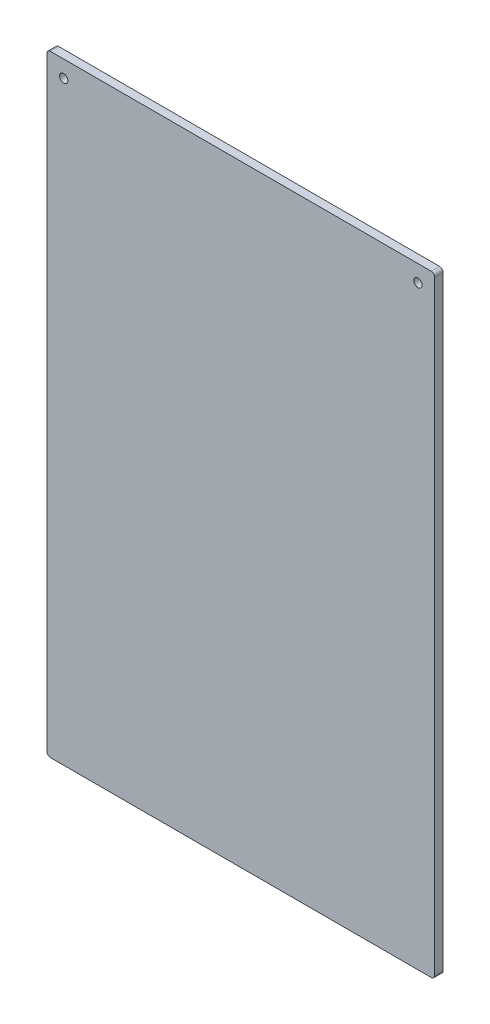
from build123d import *

# Parameters (mm, degrees)
SKETCH1_W           = 294.64
SKETCH1_H           = 464.82
SKETCH1_R           = 3.175
BOSS_EXTRUDE1_DEPTH = 6.35
FILLET1_R           = 2.54


with BuildPart() as part:
    # Sketch1 → Boss-Extrude1 (new body)
    with BuildSketch(Plane.XY):
        with Locations((147.32, 232.41)):
            Rectangle(SKETCH1_W, SKETCH1_H)
        with Locations((12.7, 452.12)):
            Circle(SKETCH1_R, mode=Mode.SUBTRACT)
        with Locations((281.94, 452.12)):
            Circle(SKETCH1_R, mode=Mode.SUBTRACT)
    extrude(amount=BOSS_EXTRUDE1_DEPTH)

    # Fillet1
    fillet1_edges = [part.edges().sort_by_distance(p)[0] for p in [
        (0, 464.82, 3.175),
        (294.64, 464.82, 3.175),
        (294.64, 0, 3.175),
        (0, 0, 3.175),
    ]]
    fillet(fillet1_edges, radius=FILLET1_R)


solid = part.part
